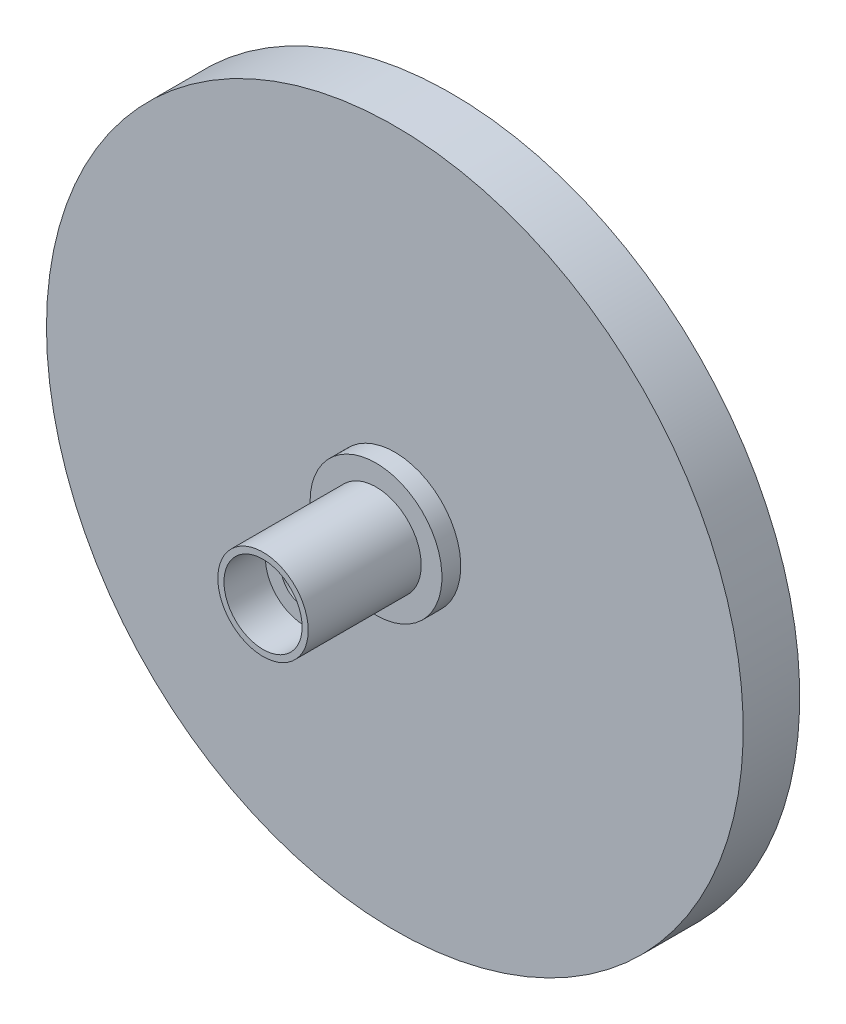
from build123d import *

# Parameters (mm, degrees)
CROQUIS1_R              = 2.4
SALIENTE_EXTRUIR1_DEPTH = 6
CROQUIS2_R              = 3.5
SALIENTE_EXTRUIR2_DEPTH = 1
CROQUIS3_R              = 18.5
SALIENTE_EXTRUIR3_DEPTH = 3
CORTAR_EXTRUIR1_DEPTH   = 2
CROQUIS5_R              = 2.075
CORTAR_EXTRUIR2_DEPTH   = 2.2
CROQUIS6_R              = 1.25
CORTAR_EXTRUIR3_DEPTH   = 28.300915736


with BuildPart() as part:
    # Croquis1 → Saliente-Extruir1 (new body)
    with BuildSketch(Plane.XY):
        Circle(CROQUIS1_R)
    extrude(amount=SALIENTE_EXTRUIR1_DEPTH)

    # Croquis2 → Saliente-Extruir2 (add)
    with BuildSketch(Plane(origin=(0, 0, 0), x_dir=(-1, 0, 0), z_dir=(0, 0, -1))):
        Circle(CROQUIS2_R)
    extrude(amount=SALIENTE_EXTRUIR2_DEPTH)

    # Croquis3 → Saliente-Extruir3 (add)
    with BuildSketch(Plane(origin=(0, 0, -1), x_dir=(-1, 0, 0), z_dir=(0, 0, -1))):
        Circle(CROQUIS3_R)
    extrude(amount=SALIENTE_EXTRUIR3_DEPTH)

    # Croquis4 → Cortar-Extruir1 (cut)
    with BuildSketch(Plane(origin=(0, 0, -4), x_dir=(-1, 0, 0), z_dir=(0, 0, -1))):
        with BuildLine():
            Line((0, 15.331093131), (-1.68173019, 12.418250997))
            ThreePointArc((-1.68173019, 12.418250997), (-1.649800286, 12.176683613), (-1.408167444, 12.145252908))
            ThreePointArc((-1.408167444, 12.145252908), (-0.72912408, 12.427844555), (0, 12.524467551))
            ThreePointArc((0, 12.524467551), (0.72912408, 12.427844555), (1.408167444, 12.145252908))
            ThreePointArc((1.408167444, 12.145252908), (1.649800286, 12.176683613), (1.68173019, 12.418250997))
            Line((1.68173019, 12.418250997), (0, 15.331093131))
        make_face()
    extrude(amount=-CORTAR_EXTRUIR1_DEPTH, mode=Mode.SUBTRACT)

    # Croquis5 → Cortar-Extruir2 (cut)
    with BuildSketch(Plane.XY.offset(6)):
        Circle(CROQUIS5_R)
    extrude(amount=-CORTAR_EXTRUIR2_DEPTH, mode=Mode.SUBTRACT)

    # Croquis6 → Cortar-Extruir3 (cut, through all)
    with BuildSketch(Plane.XY.offset(3.8)):
        Circle(CROQUIS6_R)
    extrude(amount=-CORTAR_EXTRUIR3_DEPTH, mode=Mode.SUBTRACT)


solid = part.part
